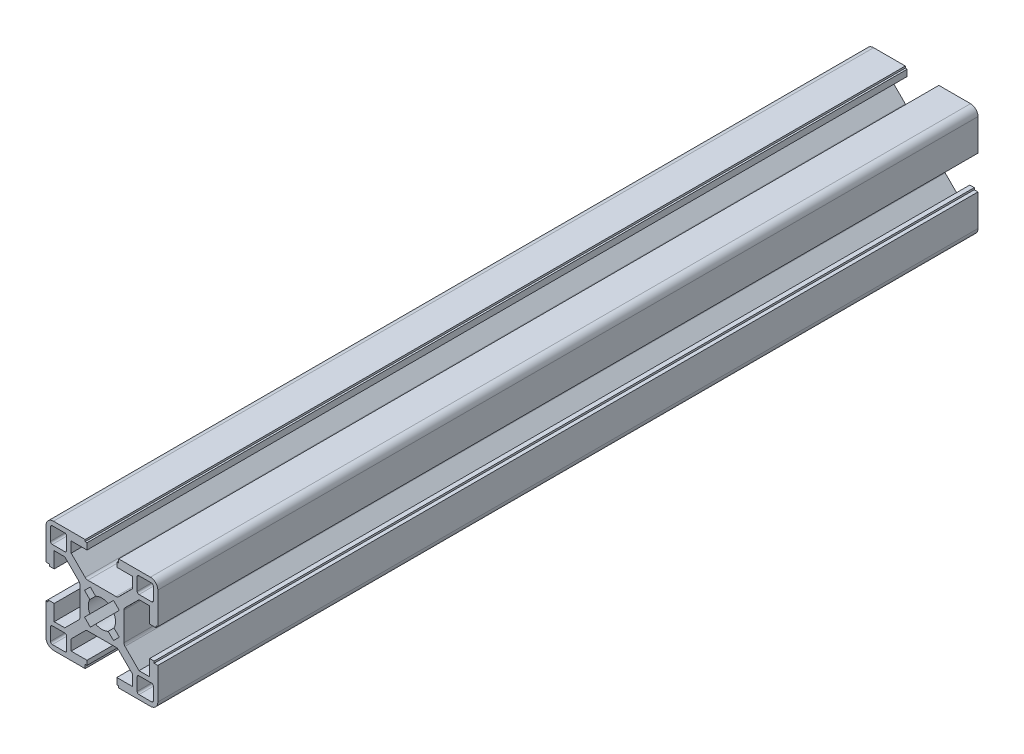
from build123d import *

# Parameters (mm, degrees)
BOSS_EXTRUDE1_DEPTH = 220


with BuildPart() as part:
    # Sketch1 → Boss-Extrude1 (new body)
    with BuildSketch(Plane.XY):
        with BuildLine():
            Line((-4.5, 14.5), (-4.5, 15))
            Line((-4.5, 15), (-13, 15))
            ThreePointArc((-13, 15), (-14.414213562, 14.414213562), (-15, 13))
            Line((-15, 13), (-15, 4.5))
            Line((-15, 4.5), (-14, 4.5))
            Line((-14, 4.5), (-14, 4))
            Line((-14, 4), (-12.8, 4))
            Line((-12.8, 4), (-12.8, 8.25))
            Line((-12.8, 8.25), (-9.95, 8.25))
            Line((-9.95, 8.25), (-6.192893219, 4.492893219))
            ThreePointArc((-6.192893219, 4.492893219), (-5.976120467, 4.16846987), (-5.9, 3.785786438))
            Line((-5.9, 3.785786438), (-5.9, -3.785786438))
            ThreePointArc((-5.9, -3.785786438), (-5.976120467, -4.16846987), (-6.192893219, -4.492893219))
            Line((-6.192893219, -4.492893219), (-9.95, -8.25))
            Line((-9.95, -8.25), (-12.8, -8.25))
            Line((-12.8, -8.25), (-12.8, -4))
            Line((-12.8, -4), (-14.5, -4))
            Line((-14.5, -4), (-14.5, -4.5))
            Line((-14.5, -4.5), (-15, -4.5))
            Line((-15, -4.5), (-15, -13))
            ThreePointArc((-15, -13), (-14.414213562, -14.414213562), (-13, -15))
            Line((-13, -15), (-4.5, -15))
            Line((-4.5, -15), (-4.5, -14))
            Line((-4.5, -14), (-4, -14))
            Line((-4, -14), (-4, -12.8))
            Line((-4, -12.8), (-8.25, -12.8))
            Line((-8.25, -12.8), (-8.25, -9.95))
            Line((-8.25, -9.95), (-4.492893219, -6.192893219))
            ThreePointArc((-4.492893219, -6.192893219), (-4.16846987, -5.976120467), (-3.785786438, -5.9))
            Line((-3.785786438, -5.9), (3.785786438, -5.9))
            ThreePointArc((3.785786438, -5.9), (4.16846987, -5.976120467), (4.492893219, -6.192893219))
            Line((4.492893219, -6.192893219), (8.25, -9.95))
            Line((8.25, -9.95), (8.25, -12.8))
            Line((8.25, -12.8), (4, -12.8))
            Line((4, -12.8), (4, -14.5))
            Line((4, -14.5), (4.5, -14.5))
            Line((4.5, -14.5), (4.5, -15))
            Line((4.5, -15), (13, -15))
            ThreePointArc((13, -15), (14.414213562, -14.414213562), (15, -13))
            Line((15, -13), (15, -4.5))
            Line((15, -4.5), (14, -4.5))
            Line((14, -4.5), (14, -4))
            Line((14, -4), (12.8, -4))
            Line((12.8, -4), (12.8, -8.25))
            Line((12.8, -8.25), (9.95, -8.25))
            Line((9.95, -8.25), (6.192893219, -4.492893219))
            ThreePointArc((6.192893219, -4.492893219), (5.976120467, -4.16846987), (5.9, -3.785786438))
            Line((5.9, -3.785786438), (5.9, 3.785786438))
            ThreePointArc((5.9, 3.785786438), (5.976120467, 4.16846987), (6.192893219, 4.492893219))
            Line((6.192893219, 4.492893219), (9.95, 8.25))
            Line((9.95, 8.25), (12.8, 8.25))
            Line((12.8, 8.25), (12.8, 4))
            Line((12.8, 4), (14.5, 4))
            Line((14.5, 4), (14.5, 4.5))
            Line((14.5, 4.5), (15, 4.5))
            Line((15, 4.5), (15, 13))
            ThreePointArc((15, 13), (14.414213562, 14.414213562), (13, 15))
            Line((13, 15), (4.5, 15))
            Line((4.5, 15), (4.5, 14))
            Line((4.5, 14), (4, 14))
            Line((4, 14), (4, 12.8))
            Line((4, 12.8), (8.25, 12.8))
            Line((8.25, 12.8), (8.25, 9.95))
            Line((8.25, 9.95), (4.492893219, 6.192893219))
            ThreePointArc((4.492893219, 6.192893219), (4.16846987, 5.976120467), (3.785786438, 5.9))
            Line((3.785786438, 5.9), (-3.785786438, 5.9))
            ThreePointArc((-3.785786438, 5.9), (-4.16846987, 5.976120467), (-4.492893219, 6.192893219))
            Line((-4.492893219, 6.192893219), (-8.25, 9.95))
            Line((-8.25, 9.95), (-8.25, 12.8))
            Line((-8.25, 12.8), (-4, 12.8))
            Line((-4, 12.8), (-4, 14.5))
            Line((-4, 14.5), (-4.5, 14.5))
        make_face()
        with BuildLine():
            Line((-9.45, -9.95), (-9.45, -13.3))
            ThreePointArc((-9.45, -13.3), (-9.596446609, -13.653553391), (-9.95, -13.8))
            Line((-9.95, -13.8), (-13.3, -13.8))
            ThreePointArc((-13.3, -13.8), (-13.653553391, -13.653553391), (-13.8, -13.3))
            Line((-13.8, -13.3), (-13.8, -9.95))
            ThreePointArc((-13.8, -9.95), (-13.653553391, -9.596446609), (-13.3, -9.45))
            Line((-13.3, -9.45), (-9.95, -9.45))
            ThreePointArc((-9.95, -9.45), (-9.596446609, -9.596446609), (-9.45, -9.95))
        make_face(mode=Mode.SUBTRACT)
        with BuildLine():
            Line((9.95, -9.45), (13.3, -9.45))
            ThreePointArc((13.3, -9.45), (13.653553391, -9.596446609), (13.8, -9.95))
            Line((13.8, -9.95), (13.8, -13.3))
            ThreePointArc((13.8, -13.3), (13.653553391, -13.653553391), (13.3, -13.8))
            Line((13.3, -13.8), (9.95, -13.8))
            ThreePointArc((9.95, -13.8), (9.596446609, -13.653553391), (9.45, -13.3))
            Line((9.45, -13.3), (9.45, -9.95))
            ThreePointArc((9.45, -9.95), (9.596446609, -9.596446609), (9.95, -9.45))
        make_face(mode=Mode.SUBTRACT)
        with BuildLine():
            Line((-9.95, 9.45), (-13.3, 9.45))
            ThreePointArc((-13.3, 9.45), (-13.653553391, 9.596446609), (-13.8, 9.95))
            Line((-13.8, 9.95), (-13.8, 13.3))
            ThreePointArc((-13.8, 13.3), (-13.653553391, 13.653553391), (-13.3, 13.8))
            Line((-13.3, 13.8), (-9.95, 13.8))
            ThreePointArc((-9.95, 13.8), (-9.596446609, 13.653553391), (-9.45, 13.3))
            Line((-9.45, 13.3), (-9.45, 9.95))
            ThreePointArc((-9.45, 9.95), (-9.596446609, 9.596446609), (-9.95, 9.45))
        make_face(mode=Mode.SUBTRACT)
        with BuildLine():
            ThreePointArc((1.683127481, -3.2387624), (0, -3.65), (-1.683127481, -3.2387624))
            Line((-1.683127481, -3.2387624), (-3.111269837, -4.666904756))
            Line((-3.111269837, -4.666904756), (-4.666904756, -3.111269837))
            Line((-4.666904756, -3.111269837), (-3.2387624, -1.683127481))
            ThreePointArc((-3.2387624, -1.683127481), (-3.65, 0), (-3.2387624, 1.683127481))
            Line((-3.2387624, 1.683127481), (-4.666904756, 3.111269837))
            Line((-4.666904756, 3.111269837), (-3.111269837, 4.666904756))
            Line((-3.111269837, 4.666904756), (-1.683127481, 3.2387624))
            ThreePointArc((-1.683127481, 3.2387624), (0, 3.65), (1.683127481, 3.2387624))
            Line((1.683127481, 3.2387624), (3.111269837, 4.666904756))
            Line((3.111269837, 4.666904756), (4.666904756, 3.111269837))
            Line((4.666904756, 3.111269837), (3.2387624, 1.683127481))
            ThreePointArc((3.2387624, 1.683127481), (3.65, 0), (3.2387624, -1.683127481))
            Line((3.2387624, -1.683127481), (4.666904756, -3.111269837))
            Line((4.666904756, -3.111269837), (3.111269837, -4.666904756))
            Line((3.111269837, -4.666904756), (1.683127481, -3.2387624))
        make_face(mode=Mode.SUBTRACT)
        with BuildLine():
            ThreePointArc((9.45, 13.3), (9.596446609, 13.653553391), (9.95, 13.8))
            Line((9.95, 13.8), (13.3, 13.8))
            ThreePointArc((13.3, 13.8), (13.653553391, 13.653553391), (13.8, 13.3))
            Line((13.8, 13.3), (13.8, 9.95))
            ThreePointArc((13.8, 9.95), (13.653553391, 9.596446609), (13.3, 9.45))
            Line((13.3, 9.45), (9.95, 9.45))
            ThreePointArc((9.95, 9.45), (9.596446609, 9.596446609), (9.45, 9.95))
            Line((9.45, 9.95), (9.45, 13.3))
        make_face(mode=Mode.SUBTRACT)
    extrude(amount=BOSS_EXTRUDE1_DEPTH)


solid = part.part
